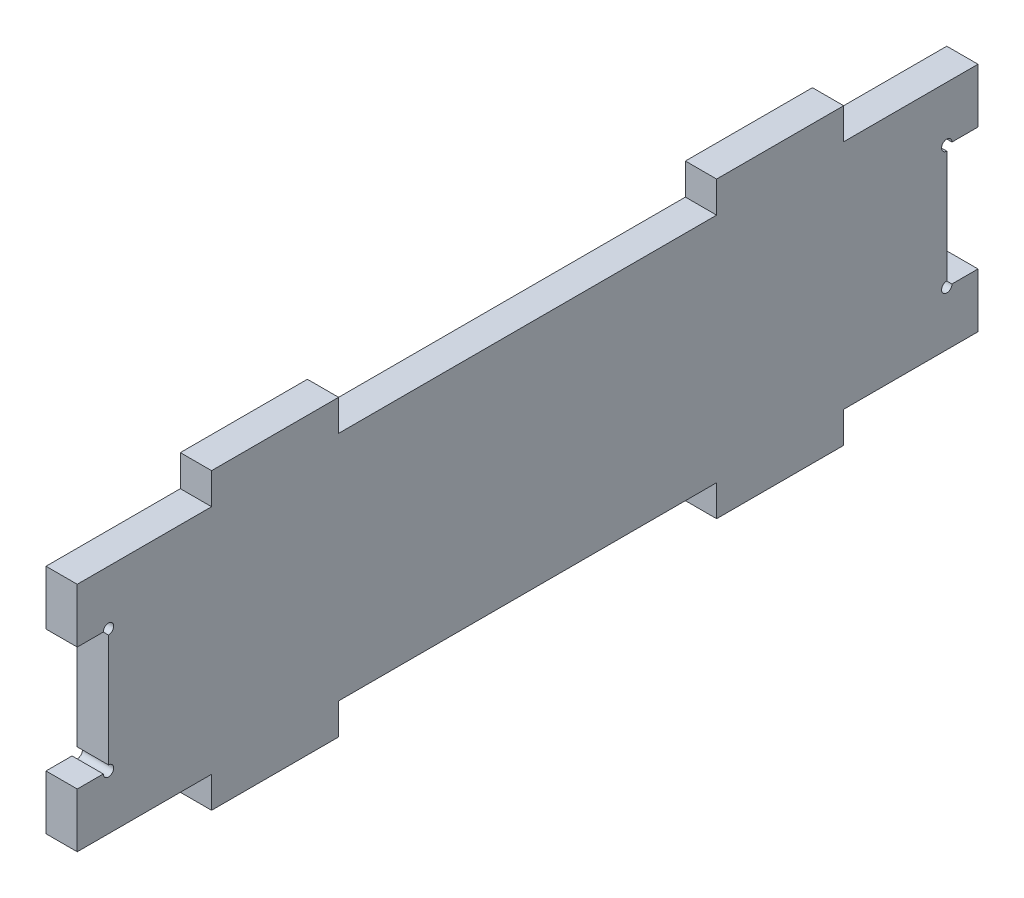
from build123d import *

# Parameters (mm, degrees)
BOSS_EXTRUDE1_DEPTH = 3


with BuildPart() as part:
    # Sketch3 → Boss-Extrude1 (new body)
    with BuildSketch(Plane(origin=(0, 0, 0), x_dir=(0, 0, -1), z_dir=(1, 0, 0))):
        with BuildLine():
            Line((61.542999323, 28.319708212), (73.742999323, 28.319708212))
            Line((73.742999323, 28.319708212), (73.742999323, 25.319708212))
            Line((73.742999323, 25.319708212), (86.642999323, 25.319708212))
            Line((86.642999323, 25.319708212), (86.642999323, 20.094708212))
            Line((86.642999323, 20.094708212), (84.142999323, 20.094708212))
            ThreePointArc((84.142999323, 20.094708212), (83.289445933, 20.448261603), (83.642999323, 19.594708212))
            Line((83.642999323, 19.594708212), (83.642999323, 8.794708212))
            ThreePointArc((83.642999323, 8.794708212), (83.289445933, 7.941154822), (84.142999323, 8.294708212))
            Line((84.142999323, 8.294708212), (86.642999323, 8.294708212))
            Line((86.642999323, 8.294708212), (86.642999323, 3.069708212))
            Line((86.642999323, 3.069708212), (73.742999323, 3.069708212))
            Line((73.742999323, 3.069708212), (73.742999323, 0.069708212))
            Line((73.742999323, 0.069708212), (61.542999323, 0.069708212))
            Line((61.542999323, 0.069708212), (61.542999323, 3.069708212))
            Line((61.542999323, 3.069708212), (25.242999323, 3.069708212))
            Line((25.242999323, 3.069708212), (25.242999323, 0.069708212))
            Line((25.242999323, 0.069708212), (13.042999323, 0.069708212))
            Line((13.042999323, 0.069708212), (13.042999323, 3.069708212))
            Line((13.042999323, 3.069708212), (0.142999323, 3.069708212))
            Line((0.142999323, 3.069708212), (0.142999323, 8.294708212))
            Line((0.142999323, 8.294708212), (2.642999323, 8.294708212))
            ThreePointArc((2.642999323, 8.294708212), (3.496552714, 7.941154822), (3.142999323, 8.794708212))
            Line((3.142999323, 8.794708212), (3.142999323, 19.594708212))
            ThreePointArc((3.142999323, 19.594708212), (3.496552714, 20.448261603), (2.642999323, 20.094708212))
            Line((2.642999323, 20.094708212), (0.142999323, 20.094708212))
            Line((0.142999323, 20.094708212), (0.142999323, 25.319708212))
            Line((0.142999323, 25.319708212), (13.042999323, 25.319708212))
            Line((13.042999323, 25.319708212), (13.042999323, 28.319708212))
            Line((13.042999323, 28.319708212), (25.242999323, 28.319708212))
            Line((25.242999323, 28.319708212), (25.242999323, 25.319708212))
            Line((25.242999323, 25.319708212), (61.542999323, 25.319708212))
            Line((61.542999323, 25.319708212), (61.542999323, 28.319708212))
        make_face()
    extrude(amount=BOSS_EXTRUDE1_DEPTH)


solid = part.part
